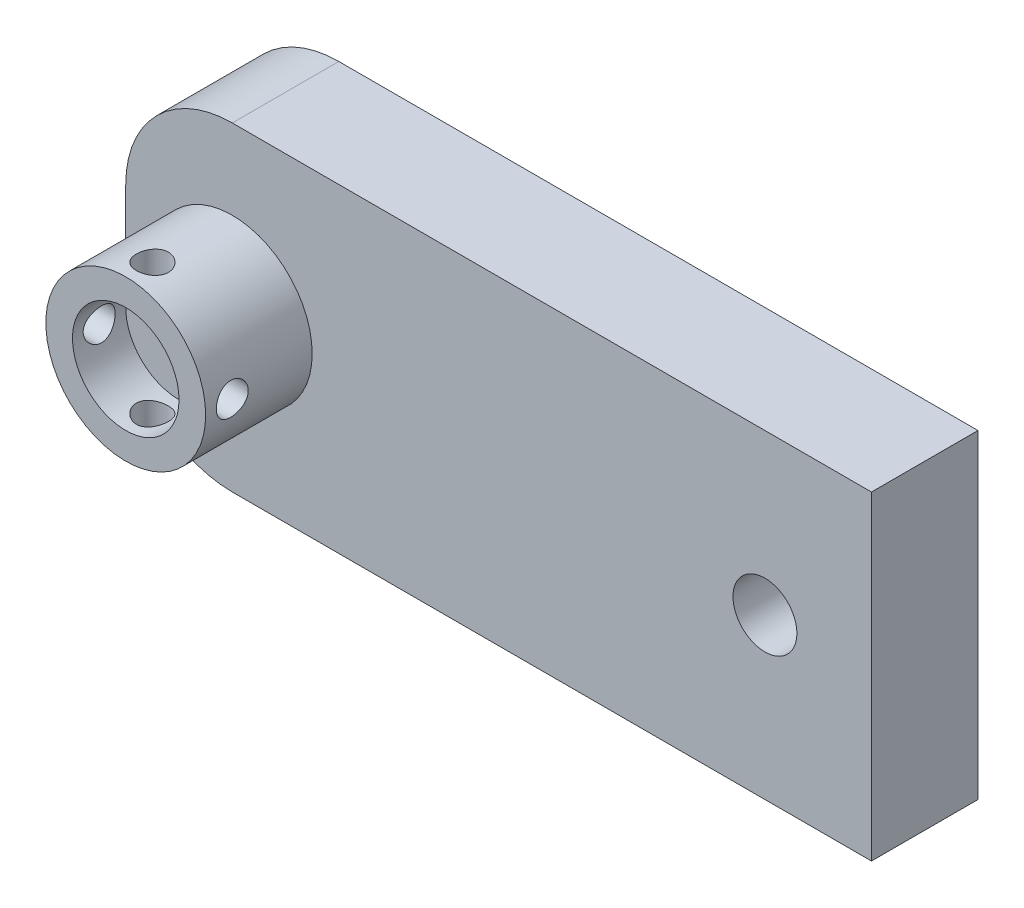
from build123d import *

# Parameters (mm, degrees)
BOSS_EXTRUDE1_DEPTH             = 10
SKETCH6_W                       = 30
SKETCH6_H                       = 25
CUT_EXTRUDE1_DEPTH              = 3
SKETCH8_R                       = 3
CUT_EXTRUDE2_DEPTH              = 10
SKETCH9_R                       = 7.5
BOSS_EXTRUDE2_DEPTH             = 10
SKETCH10_R                      = 5
CUT_EXTRUDE3_DEPTH              = 5
SKETCH11_R                      = 1.5
CUT_EXTRUDE4_DEPTH              = 49.621106648
CIRPATTERN1_COUNT               = 2
CIRPATTERN1_ANGLE               = 90
F_1_4_0_25_DIAMETER_HOLE1_D     = 6.35
F_1_4_0_25_DIAMETER_HOLE1_DEPTH = 10
F_1_4_0_25_DIAMETER_HOLE1_TIP   = 1.907732465


with BuildPart() as part:
    # Sketch1 → Boss-Extrude1 (new body)
    with BuildSketch(Plane.XY):
        with BuildLine():
            Line((-41.436145974, 5.718072987), (-41.436145974, -4.281927013))
            ThreePointArc((-41.436145974, -4.281927013), (-38.507213786, -11.352994825), (-31.436145974, -14.281927013))
            Line((-31.436145974, -14.281927013), (28.563854026, -14.281927013))
            Line((28.563854026, -14.281927013), (28.563854026, 15.718072987))
            Line((28.563854026, 15.718072987), (-31.436145974, 15.718072987))
            ThreePointArc((-31.436145974, 15.718072987), (-38.507213786, 12.789140799), (-41.436145974, 5.718072987))
        make_face()
    extrude(amount=BOSS_EXTRUDE1_DEPTH)

    # Sketch6 → Cut-Extrude1 (cut)
    with BuildSketch(Plane(origin=(0, 0, 0), x_dir=(-1, 0, 0), z_dir=(0, 0, -1))):
        with Locations((-9.563854026, 0.718072987)):
            Rectangle(SKETCH6_W, SKETCH6_H)
    extrude(amount=-CUT_EXTRUDE1_DEPTH, mode=Mode.SUBTRACT)

    # Sketch8 → Cut-Extrude2 (cut)
    with BuildSketch(Plane.XY.offset(10)):
        with Locations((18.563854026, 0.718072987)):
            Circle(SKETCH8_R)
    extrude(amount=-CUT_EXTRUDE2_DEPTH, mode=Mode.SUBTRACT)

    # Sketch9 → Boss-Extrude2 (add)
    with BuildSketch(Plane.XY.offset(10)):
        with Locations((-31.436145974, 0.718072987)):
            Circle(SKETCH9_R)
    extrude(amount=BOSS_EXTRUDE2_DEPTH)

    # Sketch10 → Cut-Extrude3 (cut)
    with BuildSketch(Plane.XY.offset(20)):
        with Locations((-31.436145974, 0.718072987)):
            Circle(SKETCH10_R)
    extrude(amount=-CUT_EXTRUDE3_DEPTH, mode=Mode.SUBTRACT)

    # Sketch11 → Cut-Extrude4 (cut, symmetric)
    with BuildSketch(Plane(origin=(0, 0, 0), x_dir=(1, 0, 0), z_dir=(0, 1, 0))):
        with Locations(Location((-31.436145974, -17.5, 0), (0, 0, 270))):
            Circle(SKETCH11_R)
    cut_extrude4 = extrude(amount=CUT_EXTRUDE4_DEPTH, both=True, mode=Mode.SUBTRACT)

    # CirPattern1: Cut-Extrude4 ×2 about axis
    cirpattern1_axis = Axis((-31.436145974, 0.718072987, 20), (0, 0, -1))
    for i in range(1, CIRPATTERN1_COUNT):
        add(cut_extrude4.rotate(cirpattern1_axis, i * CIRPATTERN1_ANGLE / (CIRPATTERN1_COUNT - 1)), mode=Mode.SUBTRACT)

    # 1/4 (0.25) Diameter Hole1
    with Locations(Plane(origin=(0, 0, 0), x_dir=(-1, 0, 0), z_dir=(0, 0, -1))):
        with Locations((31.436145974, 0.718072987)):
            Hole(F_1_4_0_25_DIAMETER_HOLE1_D / 2, depth=F_1_4_0_25_DIAMETER_HOLE1_DEPTH)
            with Locations((0, 0, -(F_1_4_0_25_DIAMETER_HOLE1_DEPTH + F_1_4_0_25_DIAMETER_HOLE1_TIP / 2))):  # 118° drill point
                Cone(0, F_1_4_0_25_DIAMETER_HOLE1_D / 2, F_1_4_0_25_DIAMETER_HOLE1_TIP, mode=Mode.SUBTRACT)


solid = part.part
